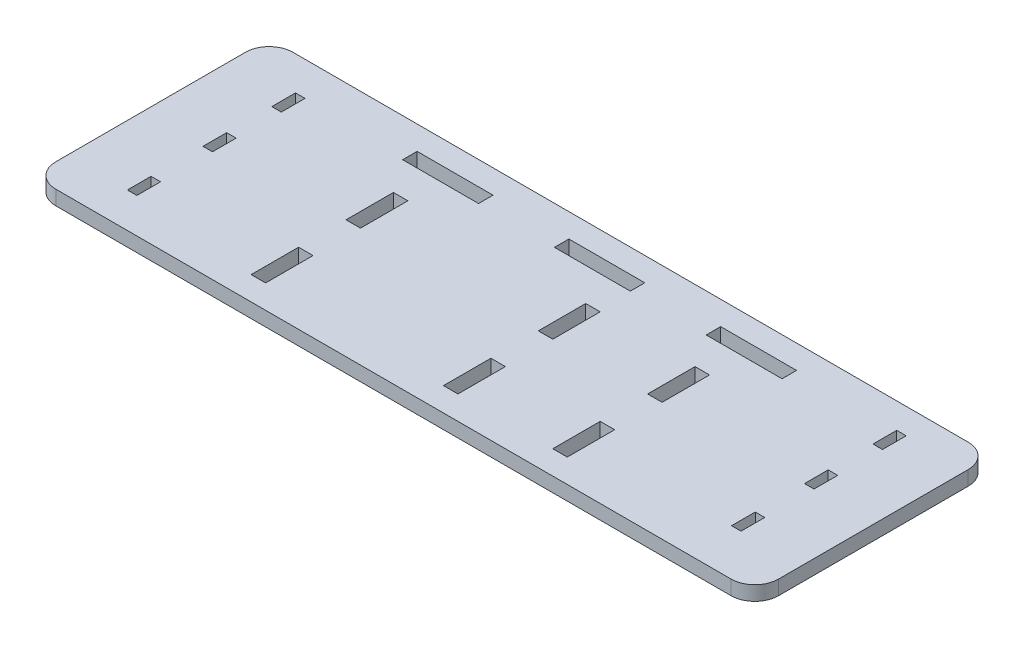
from build123d import *

# Parameters (mm, degrees)
SKETCH1_W           = 32
SKETCH1_H           = 6.1
SKETCH1_W_2         = 6.1
SKETCH1_H_2         = 20
SKETCH1_W_3         = 4
SKETCH1_H_3         = 10
BOSS_EXTRUDE1_DEPTH = 6.096


with BuildPart() as part:
    # Sketch1 → Boss-Extrude1 (new body)
    with BuildSketch(Plane(origin=(0, 0, 0), x_dir=(1, 0, 0), z_dir=(0, 1, 0))):
        with BuildLine():
            Line((-294.8, 100), (-10, 100))
            ThreePointArc((-10, 100), (-2.928932188, 97.071067812), (0, 90))
            Line((0, 90), (0, 10))
            ThreePointArc((0, 10), (-2.928932188, 2.928932188), (-10, 0))
            Line((-10, 0), (-294.8, 0))
            ThreePointArc((-294.8, 0), (-301.871067812, 2.928932188), (-304.8, 10))
            Line((-304.8, 10), (-304.8, 90))
            ThreePointArc((-304.8, 90), (-301.871067812, 97.071067812), (-294.8, 100))
        make_face()
        with Locations((-216.4, 86.95)):
            Rectangle(SKETCH1_W, SKETCH1_H, mode=Mode.SUBTRACT)
        with Locations((-152.4, 86.95)):
            Rectangle(SKETCH1_W, SKETCH1_H, mode=Mode.SUBTRACT)
        with Locations((-88.4, 86.95)):
            Rectangle(SKETCH1_W, SKETCH1_H, mode=Mode.SUBTRACT)
        with Locations((-219.35, 60)):
            Rectangle(SKETCH1_W_2, SKETCH1_H_2, mode=Mode.SUBTRACT)
        with Locations((-219.35, 20)):
            Rectangle(SKETCH1_W_2, SKETCH1_H_2, mode=Mode.SUBTRACT)
        with Locations((-27.4, 84.239115677)):
            Rectangle(SKETCH1_W_3, SKETCH1_H_3, mode=Mode.SUBTRACT)
        with Locations((-138.25, 60)):
            Rectangle(SKETCH1_W_2, SKETCH1_H_2, mode=Mode.SUBTRACT)
        with Locations((-138.25, 20)):
            Rectangle(SKETCH1_W_2, SKETCH1_H_2, mode=Mode.SUBTRACT)
        with Locations((-277.4, 80.703857292)):
            Rectangle(SKETCH1_W_3, SKETCH1_H_3, mode=Mode.SUBTRACT)
        with Locations((-92.15, 60)):
            Rectangle(SKETCH1_W_2, SKETCH1_H_2, mode=Mode.SUBTRACT)
        with Locations((-92.15, 20)):
            Rectangle(SKETCH1_W_2, SKETCH1_H_2, mode=Mode.SUBTRACT)
        with Locations((-277.4, 19.796375445)):
            Rectangle(SKETCH1_W_3, SKETCH1_H_3, mode=Mode.SUBTRACT)
        with Locations((-277.4, 51.677858863)):
            Rectangle(SKETCH1_W_3, SKETCH1_H_3, mode=Mode.SUBTRACT)
        with Locations((-27.4, 24.581782644)):
            Rectangle(SKETCH1_W_3, SKETCH1_H_3, mode=Mode.SUBTRACT)
        with Locations((-27.4, 55.358303889)):
            Rectangle(SKETCH1_W_3, SKETCH1_H_3, mode=Mode.SUBTRACT)
    extrude(amount=BOSS_EXTRUDE1_DEPTH)


solid = part.part
